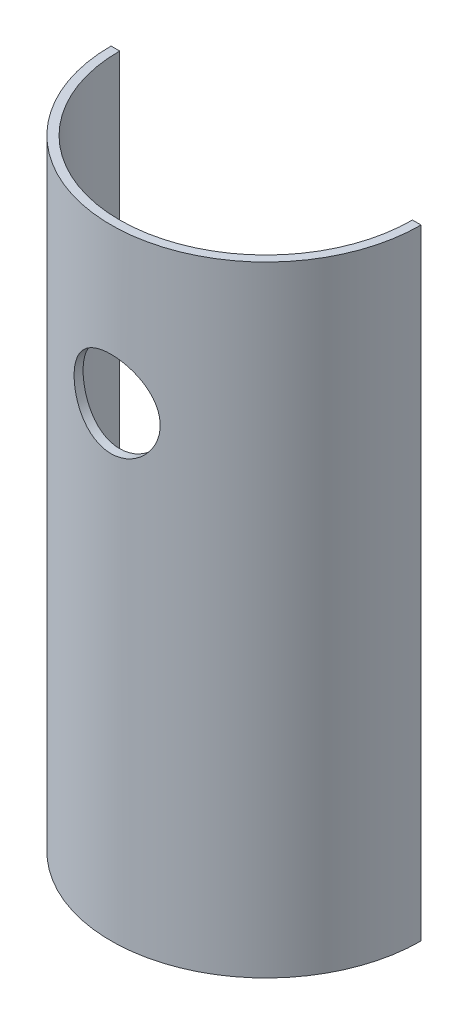
from build123d import *

# Parameters (mm, degrees)
BOSS_EXTRUDE1_DEPTH = 180
SKETCH2_R           = 12.5
CUT_EXTRUDE1_DEPTH  = 191.91883092


with BuildPart() as part:
    # Sketch1 → Boss-Extrude1 (new body)
    with BuildSketch(Plane(origin=(0, 0, 0), x_dir=(1, 0, 0), z_dir=(0, 1, 0))):
        with BuildLine():
            Line((-45, 0), (-42.5, 0))
            ThreePointArc((-42.5, 0), (0, -42.5), (42.5, 0))
            Line((42.5, 0), (45, 0))
            ThreePointArc((45, 0), (0, -45), (-45, 0))
        make_face()
    extrude(amount=BOSS_EXTRUDE1_DEPTH)

    # Sketch2 → Cut-Extrude1 (cut, through all)
    with BuildSketch(Plane.XY):
        with Locations(Location((0, 135, 0), (0, 0, 180))):
            Circle(SKETCH2_R)
    extrude(amount=CUT_EXTRUDE1_DEPTH, mode=Mode.SUBTRACT)


solid = part.part
